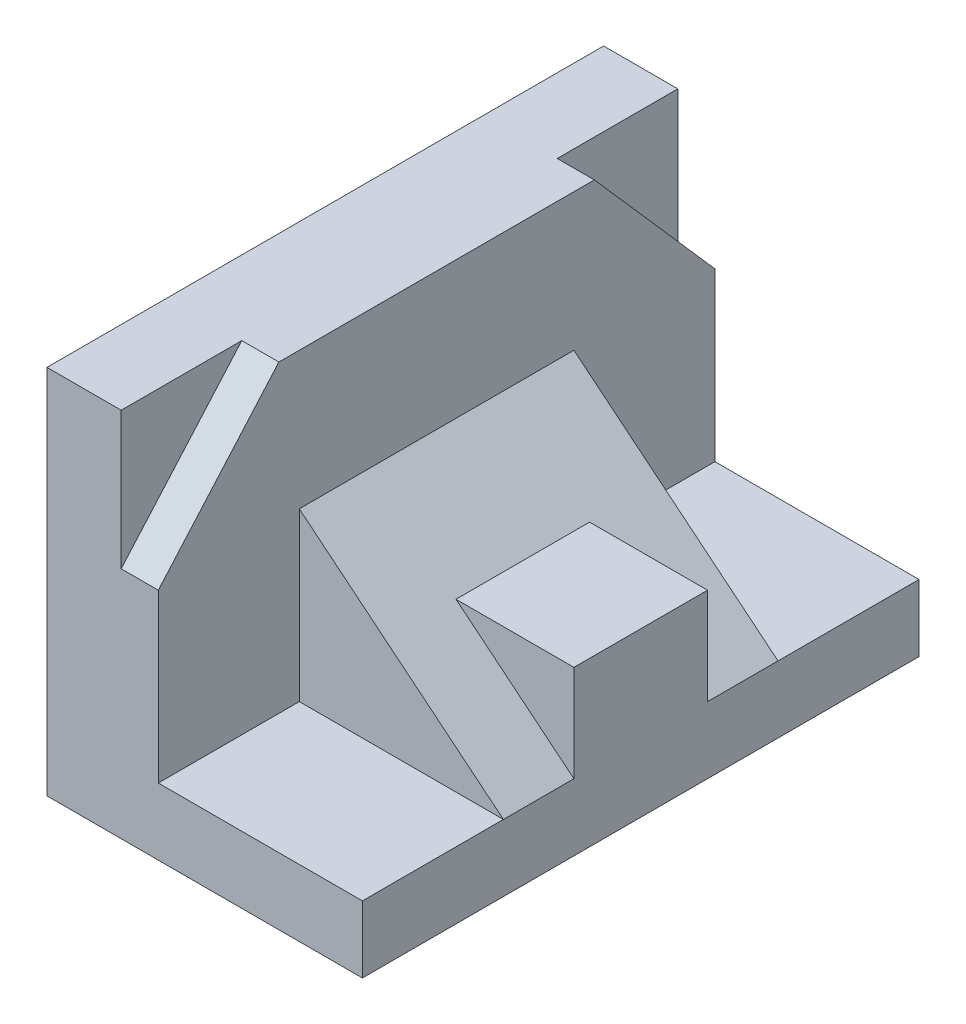
from build123d import *

# Parameters (mm, degrees)
SKETCH1_W           = 85
SKETCH1_H           = 150
BOSS_EXTRUDE1_DEPTH = 18
SKETCH2_W           = 30
SKETCH2_H           = 150
BOSS_EXTRUDE2_DEPTH = 82
SKETCH3_W           = 55
SKETCH3_H           = 74
BOSS_EXTRUDE3_DEPTH = 45
CUT_EXTRUDE1_DEPTH  = 74
SKETCH5_W           = 85
SKETCH5_H           = 36
BOSS_EXTRUDE4_DEPTH = 26
SKETCH7_W           = 150
SKETCH7_H           = 37
CUT_EXTRUDE2_DEPTH  = 10
BOSS_EXTRUDE5_DEPTH = 10


with BuildPart() as part:
    # Sketch1 → Boss-Extrude1 (new body)
    with BuildSketch(Plane(origin=(0, 0, 0), x_dir=(1, 0, 0), z_dir=(0, 1, 0))):
        with Locations((3.434439448, 45.309233449)):
            Rectangle(SKETCH1_W, SKETCH1_H)
    extrude(amount=BOSS_EXTRUDE1_DEPTH)

    # Sketch2 → Boss-Extrude2 (add)
    with BuildSketch(Plane(origin=(0, 18, 0), x_dir=(1, 0, 0), z_dir=(0, 1, 0))):
        with Locations((-24.065560552, 45.309233449)):
            Rectangle(SKETCH2_W, SKETCH2_H)
    extrude(amount=BOSS_EXTRUDE2_DEPTH)

    # Sketch3 → Boss-Extrude3 (add)
    with BuildSketch(Plane(origin=(0, 18, 0), x_dir=(1, 0, 0), z_dir=(0, 1, 0))):
        with Locations((18.434439448, 45.309233449)):
            Rectangle(SKETCH3_W, SKETCH3_H)
    extrude(amount=BOSS_EXTRUDE3_DEPTH)

    # Sketch4 → Cut-Extrude1 (cut)
    with BuildSketch(Plane.XY.offset(-8.309233449)):
        Polygon((45.934439448, 18), (-9.065560552, 63), (45.934439448, 63), align=None)
    extrude(amount=-CUT_EXTRUDE1_DEPTH, mode=Mode.SUBTRACT)

    # Sketch5 → Boss-Extrude4 (add)
    with BuildSketch(Plane(origin=(0, 18, 0), x_dir=(1, 0, 0), z_dir=(0, 1, 0))):
        with Locations((3.434439448, 45.309233449)):
            Rectangle(SKETCH5_W, SKETCH5_H)
    extrude(amount=BOSS_EXTRUDE4_DEPTH)

    # Sketch7 → Cut-Extrude2 (cut)
    with BuildSketch(Plane(origin=(-9.065560552, 0, 0), x_dir=(0, 0, -1), z_dir=(1, 0, 0))):
        with Locations((45.309233449, 81.5)):
            Rectangle(SKETCH7_W, SKETCH7_H)
    extrude(amount=-CUT_EXTRUDE2_DEPTH, mode=Mode.SUBTRACT)

    # Sketch8 → Boss-Extrude5 (add)
    with BuildSketch(Plane(origin=(-19.065560552, 0, 0), x_dir=(0, 0, -1), z_dir=(1, 0, 0))):
        Polygon((2.809233449, 100), (87.809233449, 100), (120.309233449, 63), (-29.690766551, 63), align=None)
    extrude(amount=BOSS_EXTRUDE5_DEPTH)


solid = part.part
